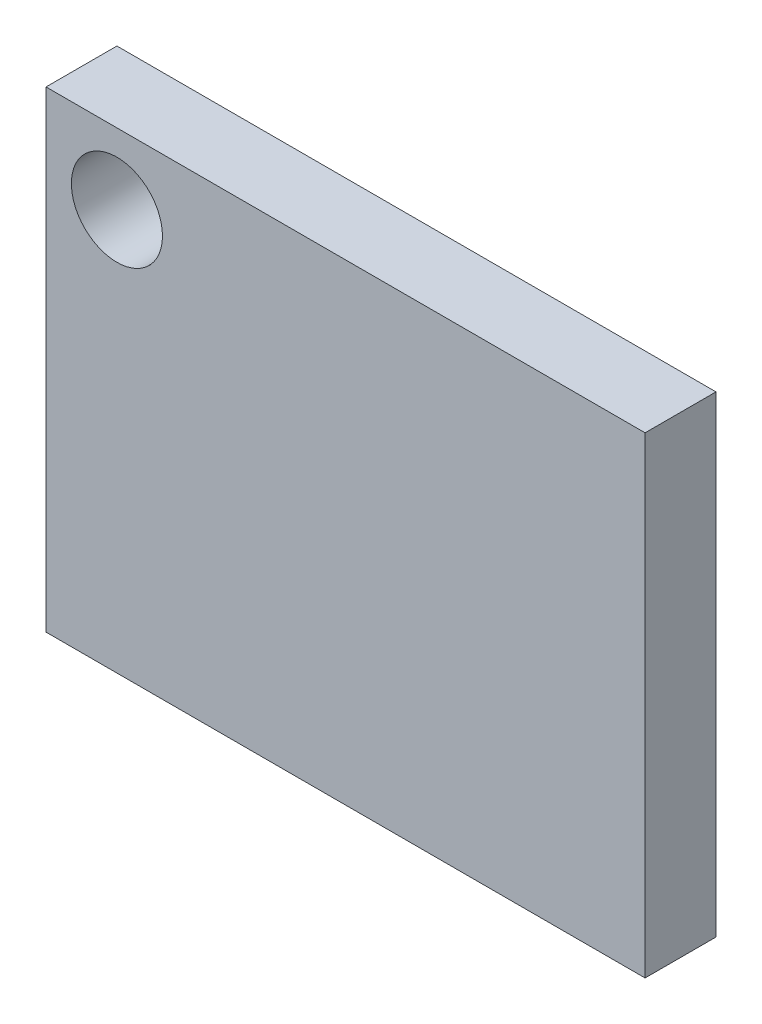
from build123d import *

# Parameters (mm, degrees)
SKETCH1_W             = 21.463
SKETCH1_H             = 16.9164
BOSS_EXTRUDE1_DEPTH   = 2.54
F_4_CLEARANCE_HOLE1_D = 3.2639


with BuildPart() as part:
    # Sketch1 → Boss-Extrude1 (new body)
    with BuildSketch(Plane.XY):
        Rectangle(SKETCH1_W, SKETCH1_H)
    extrude(amount=BOSS_EXTRUDE1_DEPTH)

    # #4 Clearance Hole1 (through all)
    with Locations(Plane.XY.offset(2.54)):
        with Locations((-8.1915, 5.9182)):
            Hole(F_4_CLEARANCE_HOLE1_D / 2)


solid = part.part
